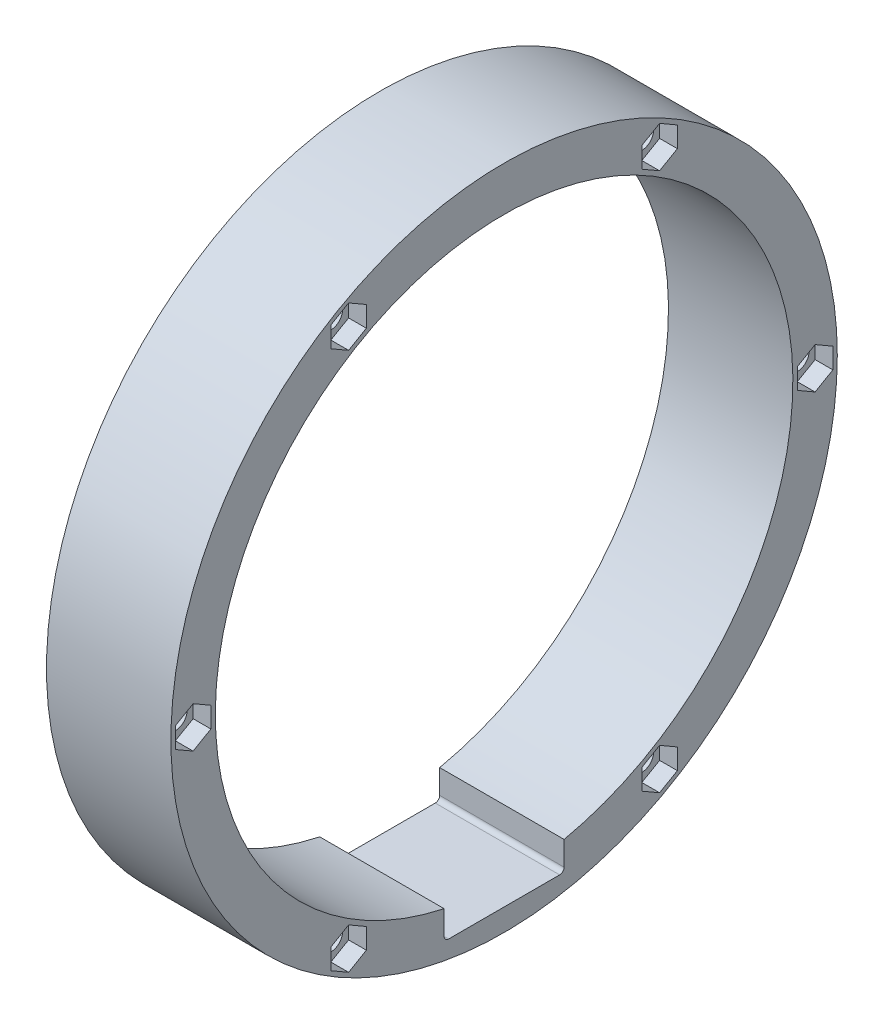
from build123d import *

# Parameters (mm, degrees)
SKETCH1_R           = 75
SKETCH1_R_2         = 65
BOSS_EXTRUDE1_DEPTH = 28
CUT_EXTRUDE1_REACH  = 111.7
CUT_EXTRUDE2_REACH  = 111.7
SKETCH3_R           = 2.65
CUT_EXTRUDE3_DEPTH  = 4


with BuildPart() as part:
    # Sketch1 → Boss-Extrude1 (new body)
    with BuildSketch(Plane(origin=(0, 0, 0), x_dir=(0, 0, -1), z_dir=(1, 0, 0))):
        Circle(SKETCH1_R)
        Circle(SKETCH1_R_2, mode=Mode.SUBTRACT)
    extrude(amount=BOSS_EXTRUDE1_DEPTH)

    # Sketch2 → Cut-Extrude1 (cut, up to next)
    with BuildSketch(Plane(origin=(28, 0, 0), x_dir=(0, 0, -1), z_dir=(1, 0, 0)), mode=Mode.PRIVATE) as cut_extrude1_sk1:
        with BuildLine():
            Line((-13.5, -51.893967527), (13.5, -51.893967527))
            Line((13.5, -51.893967527), (13.5, -69))
            ThreePointArc((13.5, -69), (13.207106781, -69.707106781), (12.5, -70))
            Line((12.5, -70), (-12.5, -70))
            ThreePointArc((-12.5, -70), (-13.207106781, -69.707106781), (-13.5, -69))
            Line((-13.5, -69), (-13.5, -51.893967527))
        make_face()
    cut_extrude1_tool1 = extrude(cut_extrude1_sk1.sketch, amount=-CUT_EXTRUDE1_REACH, mode=Mode.PRIVATE) & part.part
    add(cut_extrude1_tool1.solids().sort_by_distance((28, -60.939225, 0))[0], mode=Mode.SUBTRACT)

    # Sketch3 → Cut-Extrude2 (cut, up to next)
    with BuildSketch(Plane(origin=(28, 0, 0), x_dir=(0, 0, -1), z_dir=(1, 0, 0)), mode=Mode.PRIVATE) as cut_extrude2_sk1:
        with Locations((-70, 0)):
            Circle(SKETCH3_R)
    cut_extrude2_tool1 = extrude(cut_extrude2_sk1.sketch, amount=-CUT_EXTRUDE2_REACH, mode=Mode.PRIVATE) & part.part
    # Sketch3 → Cut-Extrude2 (cut, up to next)
    with BuildSketch(Plane(origin=(28, 0, 0), x_dir=(0, 0, -1), z_dir=(1, 0, 0)), mode=Mode.PRIVATE) as cut_extrude2_sk2:
        with Locations((-35, 60.621778265)):
            Circle(SKETCH3_R)
    cut_extrude2_tool2 = extrude(cut_extrude2_sk2.sketch, amount=-CUT_EXTRUDE2_REACH, mode=Mode.PRIVATE) & part.part
    # Sketch3 → Cut-Extrude2 (cut, up to next)
    with BuildSketch(Plane(origin=(28, 0, 0), x_dir=(0, 0, -1), z_dir=(1, 0, 0)), mode=Mode.PRIVATE) as cut_extrude2_sk3:
        with Locations((35, 60.621778265)):
            Circle(SKETCH3_R)
    cut_extrude2_tool3 = extrude(cut_extrude2_sk3.sketch, amount=-CUT_EXTRUDE2_REACH, mode=Mode.PRIVATE) & part.part
    # Sketch3 → Cut-Extrude2 (cut, up to next)
    with BuildSketch(Plane(origin=(28, 0, 0), x_dir=(0, 0, -1), z_dir=(1, 0, 0)), mode=Mode.PRIVATE) as cut_extrude2_sk4:
        with Locations((70, 0)):
            Circle(SKETCH3_R)
    cut_extrude2_tool4 = extrude(cut_extrude2_sk4.sketch, amount=-CUT_EXTRUDE2_REACH, mode=Mode.PRIVATE) & part.part
    # Sketch3 → Cut-Extrude2 (cut, up to next)
    with BuildSketch(Plane(origin=(28, 0, 0), x_dir=(0, 0, -1), z_dir=(1, 0, 0)), mode=Mode.PRIVATE) as cut_extrude2_sk5:
        with Locations((35, -60.621778265)):
            Circle(SKETCH3_R)
    cut_extrude2_tool5 = extrude(cut_extrude2_sk5.sketch, amount=-CUT_EXTRUDE2_REACH, mode=Mode.PRIVATE) & part.part
    # Sketch3 → Cut-Extrude2 (cut, up to next)
    with BuildSketch(Plane(origin=(28, 0, 0), x_dir=(0, 0, -1), z_dir=(1, 0, 0)), mode=Mode.PRIVATE) as cut_extrude2_sk6:
        with Locations((-35, -60.621778265)):
            Circle(SKETCH3_R)
    cut_extrude2_tool6 = extrude(cut_extrude2_sk6.sketch, amount=-CUT_EXTRUDE2_REACH, mode=Mode.PRIVATE) & part.part
    add(cut_extrude2_tool1.solids().sort_by_distance((28, 0, 70))[0], mode=Mode.SUBTRACT)
    add(cut_extrude2_tool2.solids().sort_by_distance((28, 60.621778, 35))[0], mode=Mode.SUBTRACT)
    add(cut_extrude2_tool3.solids().sort_by_distance((28, 60.621778, -35))[0], mode=Mode.SUBTRACT)
    add(cut_extrude2_tool4.solids().sort_by_distance((28, 0, -70))[0], mode=Mode.SUBTRACT)
    add(cut_extrude2_tool5.solids().sort_by_distance((28, -60.621778, -35))[0], mode=Mode.SUBTRACT)
    add(cut_extrude2_tool6.solids().sort_by_distance((28, -60.621778, 35))[0], mode=Mode.SUBTRACT)

    # Sketch4 → Cut-Extrude3 (cut)
    with BuildSketch(Plane(origin=(28, 0, 0), x_dir=(0, 0, -1), z_dir=(1, 0, 0))):
        Polygon((-39, 58.312377188), (-35, 56.002976111), (-31, 58.312377188), (-31, 62.931179342), (-35, 65.240580418), (-39, 62.931179342), align=None)
        Polygon((-70, -4.618802154), (-66, -2.309401077), (-66, 2.309401077), (-70, 4.618802154), (-74, 2.309401077), (-74, -2.309401077), align=None)
        Polygon((31, 62.931179342), (31, 58.312377188), (35, 56.002976111), (39, 58.312377188), (39, 62.931179342), (35, 65.240580418), align=None)
        Polygon((70, 4.618802154), (66, 2.309401077), (66, -2.309401077), (70, -4.618802154), (74, -2.309401077), (74, 2.309401077), align=None)
        Polygon((39, -58.312377188), (35, -56.002976111), (31, -58.312377188), (31, -62.931179342), (35, -65.240580418), (39, -62.931179342), align=None)
        Polygon((-31, -62.931179342), (-31, -58.312377188), (-35, -56.002976111), (-39, -58.312377188), (-39, -62.931179342), (-35, -65.240580418), align=None)
    extrude(amount=-CUT_EXTRUDE3_DEPTH, mode=Mode.SUBTRACT)


solid = part.part
